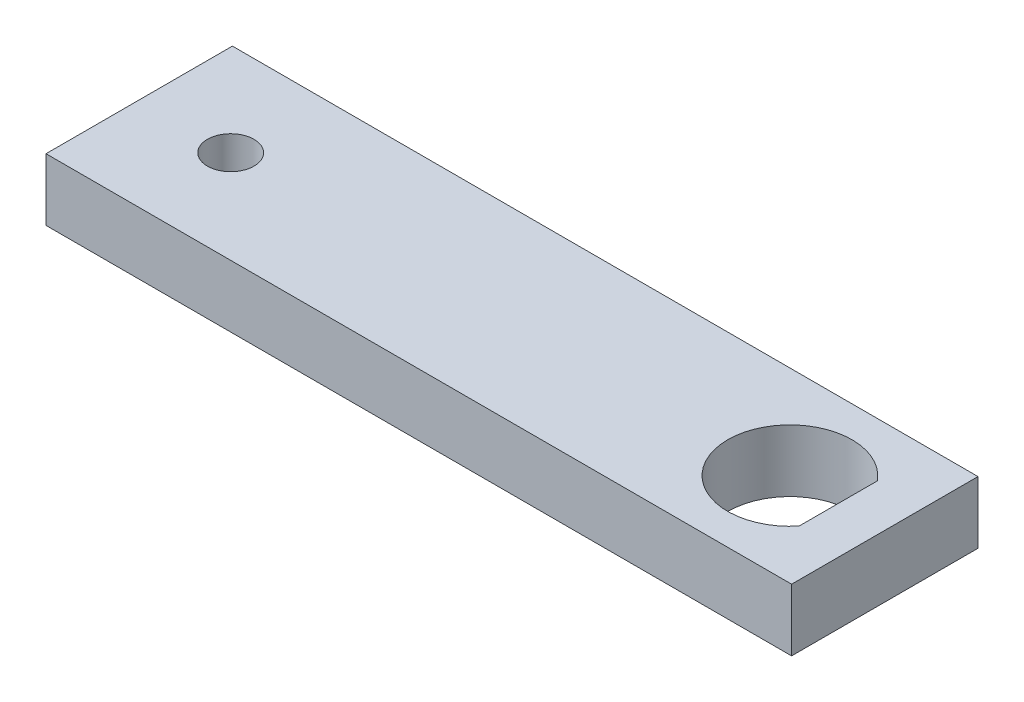
from build123d import *

# Parameters (mm, degrees)
SKETCH1_W           = 76.2
SKETCH1_H           = 19.05
SKETCH1_R           = 2.38
BOSS_EXTRUDE1_DEPTH = 3.175


with BuildPart() as part:
    # Sketch1 → Boss-Extrude1 (new, symmetric)
    with BuildSketch(Plane(origin=(0, 0, 0), x_dir=(1, 0, 0), z_dir=(0, 1, 0))):
        Rectangle(SKETCH1_W, SKETCH1_H)
        with Locations(Location((-28.75, 0, 0), (0, 0, 270))):
            Circle(SKETCH1_R, mode=Mode.SUBTRACT)
        with BuildLine():
            Line((33.34, 3.989849621), (33.34, -3.989849621))
            ThreePointArc((33.34, -3.989849621), (22.05, 0), (33.34, 3.989849621))
        make_face(mode=Mode.SUBTRACT)
    extrude(amount=BOSS_EXTRUDE1_DEPTH, both=True)


solid = part.part
